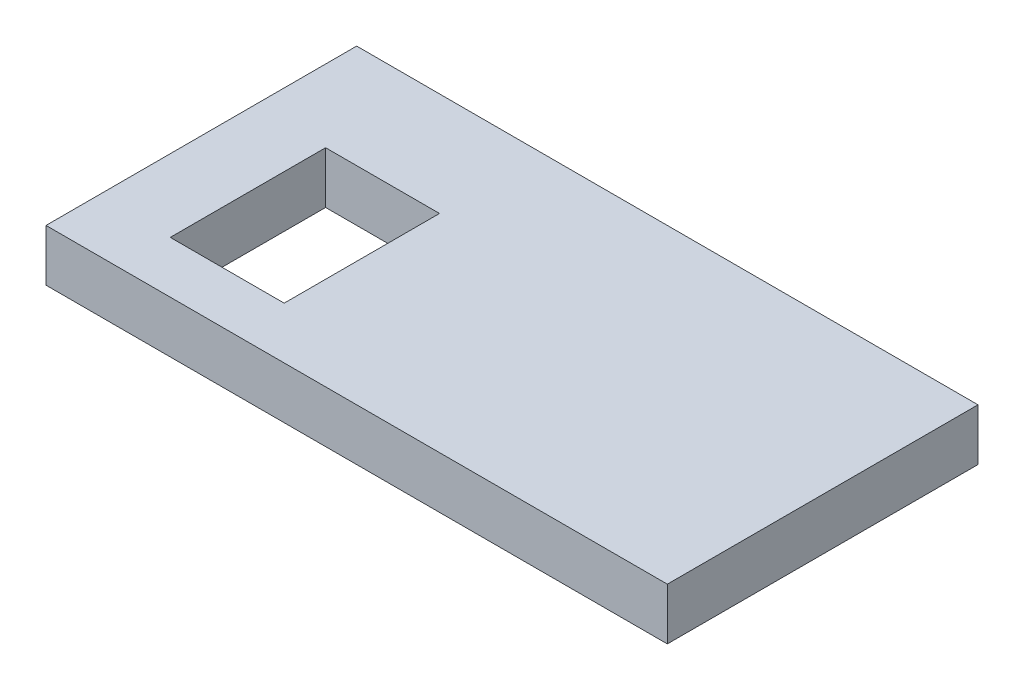
from build123d import *

# Parameters (mm, degrees)
SKIZZE1_W                       = 120
SKIZZE1_H                       = 50
AUFSATZ_LINEAR_AUSTRAGEN1_DEPTH = 10
SKIZZE3_W                       = 22
SKIZZE3_H                       = 30
SCHNITT_LINEAR_AUSTRAGEN1_DEPTH = 66.76473219
SKIZZE4_W                       = 120
SKIZZE4_H                       = 10
AUFSATZ_LINEAR_AUSTRAGEN2_DEPTH = 10


with BuildPart() as part:
    # Skizze1 → Aufsatz-Linear austragen1 (new body)
    with BuildSketch(Plane(origin=(0, 0, 0), x_dir=(1, 0, 0), z_dir=(0, 1, 0))):
        Rectangle(SKIZZE1_W, SKIZZE1_H)
    extrude(amount=AUFSATZ_LINEAR_AUSTRAGEN1_DEPTH)

    # Skizze3 → Schnitt-Linear austragen1 (cut, through all)
    with BuildSketch(Plane(origin=(0, 10, 0), x_dir=(1, 0, 0), z_dir=(0, 1, 0))):
        with Locations((-35, 0)):
            Rectangle(SKIZZE3_W, SKIZZE3_H)
    extrude(amount=-SCHNITT_LINEAR_AUSTRAGEN1_DEPTH, mode=Mode.SUBTRACT)

    # Skizze4 → Aufsatz-Linear austragen2 (add)
    with BuildSketch(Plane(origin=(0, 10, 0), x_dir=(1, 0, 0), z_dir=(0, 1, 0))):
        with Locations((0, 30)):
            Rectangle(SKIZZE4_W, SKIZZE4_H)
    extrude(amount=-AUFSATZ_LINEAR_AUSTRAGEN2_DEPTH)


solid = part.part
